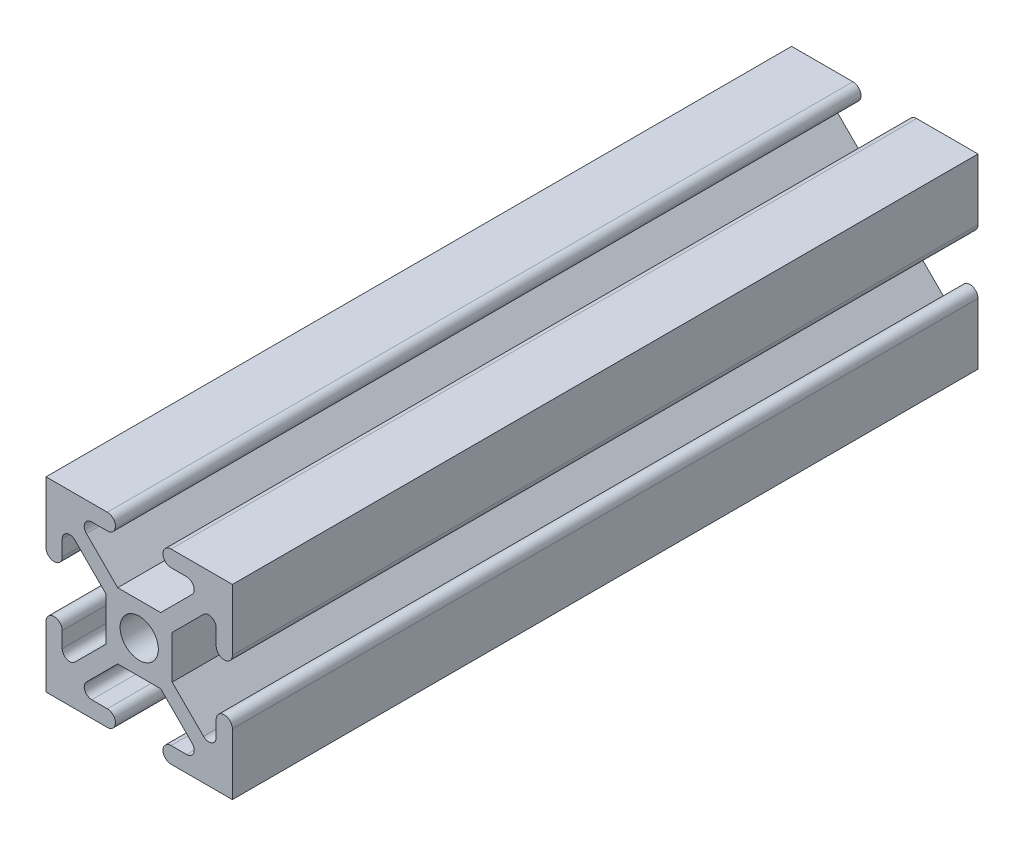
from build123d import *

# Parameters (mm, degrees)
SKETCH1_R           = 2.6035
BOSS_EXTRUDE1_DEPTH = 101.6


with BuildPart() as part:
    # Sketch1 → Boss-Extrude1 (new body)
    with BuildSketch(Plane.XY):
        with BuildLine():
            Line((-12.7, -12.7), (-4.343399971, -12.7))
            ThreePointArc((-4.343399971, -12.7), (-3.238499971, -11.5951), (-4.343399971, -10.4902))
            Line((-4.343399971, -10.4902), (-6.474794456, -10.4902))
            ThreePointArc((-6.474794456, -10.4902), (-7.413456061, -9.863006367), (-7.193214945, -8.75577951))
            Line((-7.193214945, -8.75577951), (-2.933235435, -4.4958))
            Line((-2.933235435, -4.4958), (2.933235435, -4.4958))
            Line((2.933235435, -4.4958), (7.193214945, -8.75577951))
            ThreePointArc((7.193214945, -8.75577951), (7.413456061, -9.863006367), (6.474794456, -10.4902))
            Line((6.474794456, -10.4902), (4.3434, -10.4902))
            ThreePointArc((4.3434, -10.4902), (3.2385, -11.5951), (4.3434, -12.7))
            Line((4.3434, -12.7), (12.7, -12.7))
            Line((12.7, -12.7), (12.7, -4.343399971))
            ThreePointArc((12.7, -4.343399971), (11.5951, -3.238499971), (10.4902, -4.343399971))
            Line((10.4902, -4.343399971), (10.4902, -6.474794456))
            ThreePointArc((10.4902, -6.474794456), (9.863006367, -7.413456061), (8.75577951, -7.193214945))
            Line((8.75577951, -7.193214945), (4.4958, -2.933235435))
            Line((4.4958, -2.933235435), (4.4958, 2.933235435))
            Line((4.4958, 2.933235435), (8.75577951, 7.193214945))
            ThreePointArc((8.75577951, 7.193214945), (9.863006367, 7.413456061), (10.4902, 6.474794456))
            Line((10.4902, 6.474794456), (10.4902, 4.3434))
            ThreePointArc((10.4902, 4.3434), (11.5951, 3.2385), (12.7, 4.3434))
            Line((12.7, 4.3434), (12.7, 12.7))
            Line((12.7, 12.7), (4.343399971, 12.7))
            ThreePointArc((4.343399971, 12.7), (3.238499971, 11.5951), (4.343399971, 10.4902))
            Line((4.343399971, 10.4902), (6.474794456, 10.4902))
            ThreePointArc((6.474794456, 10.4902), (7.413456061, 9.863006367), (7.193214945, 8.75577951))
            Line((7.193214945, 8.75577951), (2.933235435, 4.4958))
            Line((2.933235435, 4.4958), (-2.933235435, 4.4958))
            Line((-2.933235435, 4.4958), (-7.193214945, 8.75577951))
            ThreePointArc((-7.193214945, 8.75577951), (-7.413456061, 9.863006367), (-6.474794456, 10.4902))
            Line((-6.474794456, 10.4902), (-4.3434, 10.4902))
            ThreePointArc((-4.3434, 10.4902), (-3.2385, 11.5951), (-4.3434, 12.7))
            Line((-4.3434, 12.7), (-12.7, 12.7))
            Line((-12.7, 12.7), (-12.7, 4.343399971))
            ThreePointArc((-12.7, 4.343399971), (-11.5951, 3.238499971), (-10.4902, 4.343399971))
            Line((-10.4902, 4.343399971), (-10.4902, 6.474794456))
            ThreePointArc((-10.4902, 6.474794456), (-9.863006367, 7.413456061), (-8.75577951, 7.193214945))
            Line((-8.75577951, 7.193214945), (-4.4958, 2.933235435))
            Line((-4.4958, 2.933235435), (-4.4958, -2.933235435))
            Line((-4.4958, -2.933235435), (-8.75577951, -7.193214945))
            ThreePointArc((-8.75577951, -7.193214945), (-9.863006367, -7.413456061), (-10.4902, -6.474794456))
            Line((-10.4902, -6.474794456), (-10.4902, -4.3434))
            ThreePointArc((-10.4902, -4.3434), (-11.5951, -3.2385), (-12.7, -4.3434))
            Line((-12.7, -4.3434), (-12.7, -12.7))
        make_face()
        with Locations(Location((0, 0, 0), (0, 0, 180))):
            Circle(SKETCH1_R, mode=Mode.SUBTRACT)
    extrude(amount=-BOSS_EXTRUDE1_DEPTH)


solid = part.part
